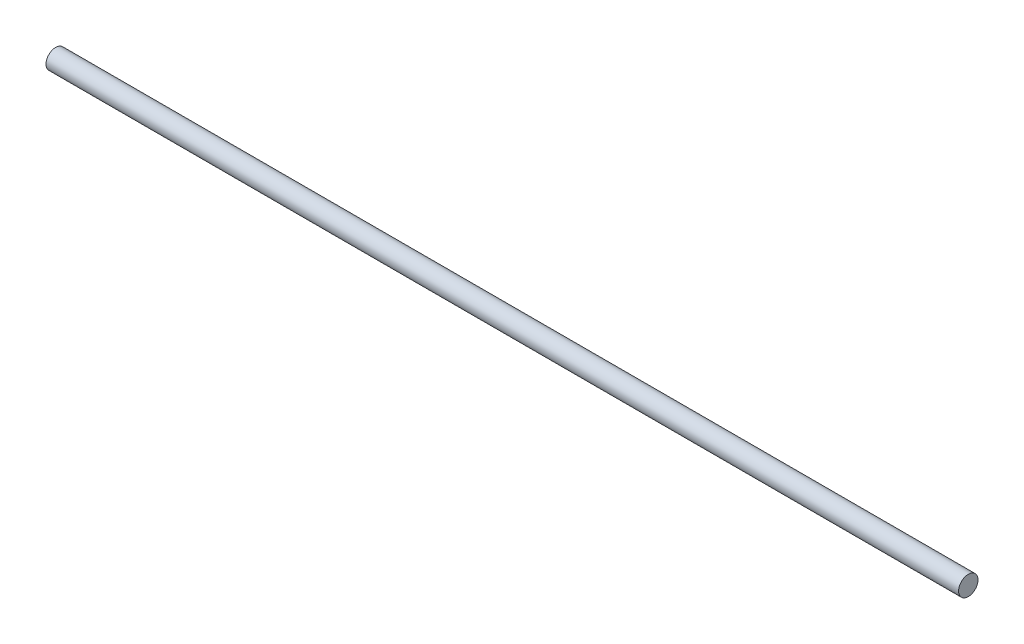
from build123d import *

# Parameters (mm, degrees)
SKETCH4_R           = 20
BOSS_EXTRUDE2_DEPTH = 1880


with BuildPart() as part:
    # Sketch4 → Boss-Extrude2 (new body)
    with BuildSketch(Plane(origin=(0, 0, 0), x_dir=(0, 0, -1), z_dir=(1, 0, 0))):
        with Locations(Location((-1405.79287706, -82.434692834, 0), (0, 0, 180))):
            Circle(SKETCH4_R)
    extrude(amount=BOSS_EXTRUDE2_DEPTH)


solid = part.part
